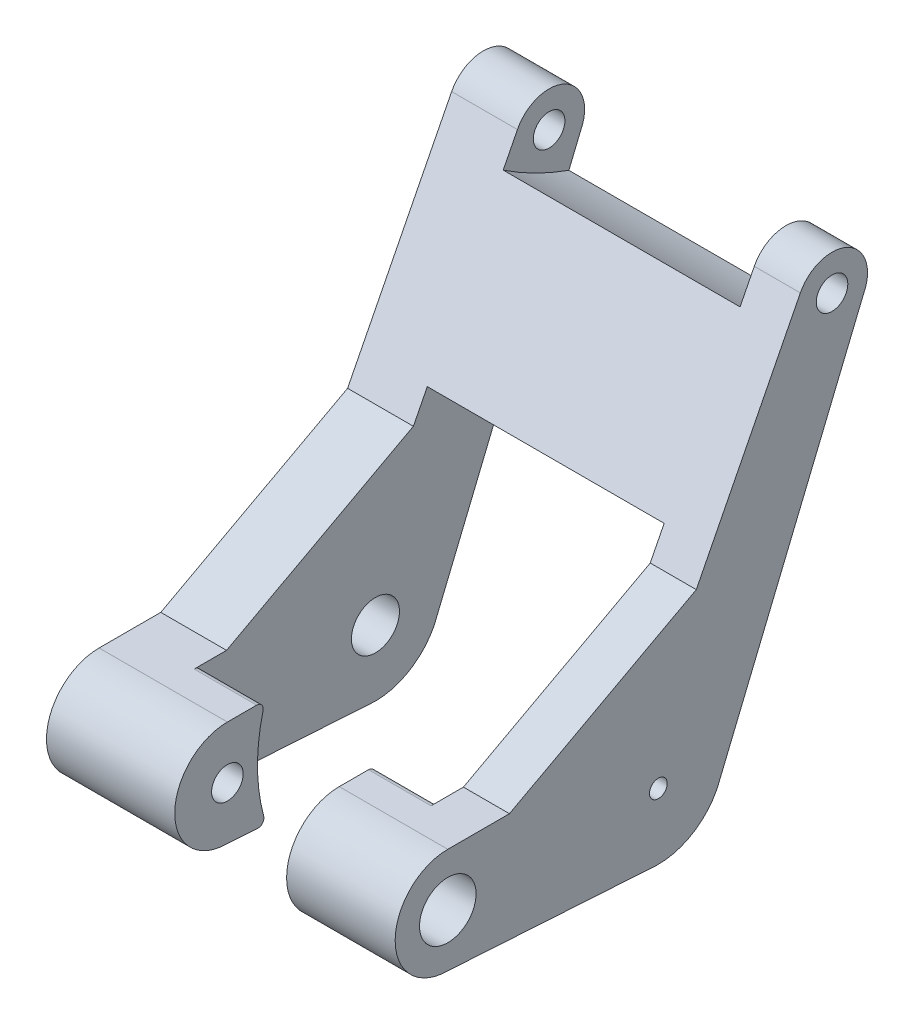
from build123d import *
from build123d.topology import SkipClean

# Parameters (mm, degrees)
SKETCH19_R           = 2.4
SKETCH19_R_2         = 3.65
BASE_DEPTH           = 10
CONNECTOR_DEPTH      = 36
SKETCH21_R           = 2.4
SKETCH21_R_2         = 1.35
THINPLATE_DEPTH      = 7
SPACER_START         = 6
SKETCH22_R           = 3
SKETCH22_R_2         = 1.35
SPACER_DEPTH         = 6
SHOCKHOLE_DEPTH      = 83.760860315
SKETCH25_R           = 2.4
SHOCKSCREWHOLE_DEPTH = 88.771065847
SKETCH26_R           = 4.3
BOLTMOUNT_DEPTH      = 8.6
NUTMOUNT_DEPTH       = 8


with BuildPart() as part:
    # Sketch19 → Base (new body)
    with BuildSketch(Plane(origin=(0, 0, 0), x_dir=(0, 0, -1), z_dir=(1, 0, 0))):
        with BuildLine():
            Line((-32, -8), (-2.8782e-05, -9.999989824))
            ThreePointArc((-2.8782e-05, -9.999989824), (5.231162179, -8.522585739), (8.916636561, -4.52691805))
            Line((8.916636561, -4.52691805), (31.214999285, 49.555458758))
            ThreePointArc((31.214999285, 49.555458758), (28.844541242, 56.814999285), (21.585000715, 54.444541242))
            Line((21.585000715, 54.444541242), (5.771017186, 23.295825861))
            Line((5.771017186, 23.295825861), (-22.627449378, 8))
            Line((-22.627449378, 8), (-32, 8))
            ThreePointArc((-32, 8), (-40, 0), (-32, -8))
        make_face()
        with Locations((26.4, 52)):
            Circle(SKETCH19_R, mode=Mode.SUBTRACT)
        with Locations((-2.8782e-05, 1.0176e-05)):
            Circle(SKETCH19_R_2, mode=Mode.SUBTRACT)
        with Locations((-32, 0)):
            Circle(SKETCH19_R, mode=Mode.SUBTRACT)
    extrude(amount=BASE_DEPTH)

    # Sketch20 → Connector (add)
    with BuildSketch(Plane(origin=(10, 0, 0), x_dir=(0, 0, -1), z_dir=(1, 0, 0))):
        with BuildLine():
            Line((-27.54952713, 8), (-32, 8))
            ThreePointArc((-32, 8), (-40, 0), (-32, -8))
            Line((-32, -8), (-27.086315803, -8.307103976))
            ThreePointArc((-27.086315803, -8.307103976), (-26.558475485, -7.826611078), (-26.485482069, -7.116568271))
            ThreePointArc((-26.485482069, -7.116568271), (-27.424283751, -0.187510507), (-26.580323996, 6.753737364))
            ThreePointArc((-26.580323996, 6.753737364), (-26.760140458, 7.613896312), (-27.54952713, 8))
        make_face()
        with BuildLine():
            Line((19.422577767, 50.185228792), (7.885841247, 27.461383049))
            ThreePointArc((7.885841247, 27.461383049), (14.036502787, 24.885542674), (19.422577767, 20.954157761))
            Line((19.422577767, 20.954157761), (29.406128946, 45.16823049))
            ThreePointArc((29.406128946, 45.16823049), (24.260347085, 47.370265615), (19.422577767, 50.185228792))
        make_face()
    extrude(amount=CONNECTOR_DEPTH)

    # Sketch21 → ThinPlate (add)
    with BuildSketch(Plane(origin=(46, 0, 0), x_dir=(0, 0, -1), z_dir=(1, 0, 0))):
        with BuildLine():
            Line((-22.627449378, 8), (-27.540134214, 8))
            Line((-27.540134214, 8), (-32, 8))
            ThreePointArc((-32, 8), (-40, 0), (-32, -8))
            Line((-32, -8), (-26.743480668, -8.328531082))
            Line((-26.743480668, -8.328531082), (-0.196731301, -9.987695968))
            ThreePointArc((-0.196731301, -9.987695968), (5.145129551, -8.567670884), (8.916636561, -4.52691805))
            Line((8.916636561, -4.52691805), (19.422577767, 20.954157761))
            Line((19.422577767, 20.954157761), (27.143694623, 39.680929602))
            Line((27.143694623, 39.680929602), (31.214999285, 49.555458758))
            ThreePointArc((31.214999285, 49.555458758), (28.844541242, 56.814999285), (21.585000715, 54.444541242))
            Line((21.585000715, 54.444541242), (17.595211042, 46.585874718))
            Line((17.595211042, 46.585874718), (5.771017186, 23.295825861))
            Line((5.771017186, 23.295825861), (0, 20.187472327))
            Line((0, 20.187472327), (-22.627449378, 8))
        make_face()
        with Locations((26.4, 52)):
            Circle(SKETCH21_R, mode=Mode.SUBTRACT)
        with Locations(Location((-32, 0, 0), (0, 0, 180))):
            Circle(SKETCH21_R, mode=Mode.SUBTRACT)
        with Locations((0.005188187, 0.010260161)):
            Circle(SKETCH21_R_2, mode=Mode.SUBTRACT)
    extrude(amount=THINPLATE_DEPTH)

    # Sketch22 → Spacer (add)
    with SkipClean():  # the faces are left unmerged after this step: merging them gives an invalid solid
        with BuildSketch(Plane.ZY.offset(-46).offset(SPACER_START)):
            with Locations(Location((-0.005188187, 0.010260161, 0), (0, 0, 180))):
                Circle(SKETCH22_R)
            with Locations((-0.005188187, 0.010260161)):
                Circle(SKETCH22_R_2, mode=Mode.SUBTRACT)
        extrude(amount=-SPACER_DEPTH)

    # Sketch23 → ShockHole (cut, through all)
    with SkipClean():  # the faces are left unmerged after this step: merging them gives an invalid solid
        with BuildSketch(Plane(origin=(0, 8, 0), x_dir=(1, 0, 0), z_dir=(0, 1, 0))):
            Polygon((19.5, -32), (19.5, -40.5), (36.5, -40.5), (36.5, -32), (36.5, -23.5), (19.5, -23.5), align=None)
        extrude(amount=-SHOCKHOLE_DEPTH, mode=Mode.SUBTRACT)

    # Sketch25 → ShockScrewHole (cut, through all)
    with BuildSketch(Plane.ZY):
        with Locations((32, 0)):
            Circle(SKETCH25_R)
    extrude(amount=-SHOCKSCREWHOLE_DEPTH, mode=Mode.SUBTRACT)

    # Sketch26 → BoltMount (cut)
    with SkipClean():  # the faces are left unmerged after this step: merging them gives an invalid solid
        with BuildSketch(Plane(origin=(53, 0, 0), x_dir=(0, 0, -1), z_dir=(1, 0, 0))):
            with Locations((-32, 0)):
                Circle(SKETCH26_R)
        extrude(amount=-BOLTMOUNT_DEPTH, mode=Mode.SUBTRACT)

    # Sketch27 → NutMount (cut)
    with SkipClean():  # the faces are left unmerged after this step: merging them gives an invalid solid
        with BuildSketch(Plane.ZY):
            Polygon((35.297994862, -2.894229297), (36.155473526, 1.409032684), (32.857478664, 4.303261981), (28.702005138, 2.894229297), (27.844526474, -1.409032684), (31.142521336, -4.303261981), align=None)
        extrude(amount=-NUTMOUNT_DEPTH, mode=Mode.SUBTRACT)


solid = part.part
